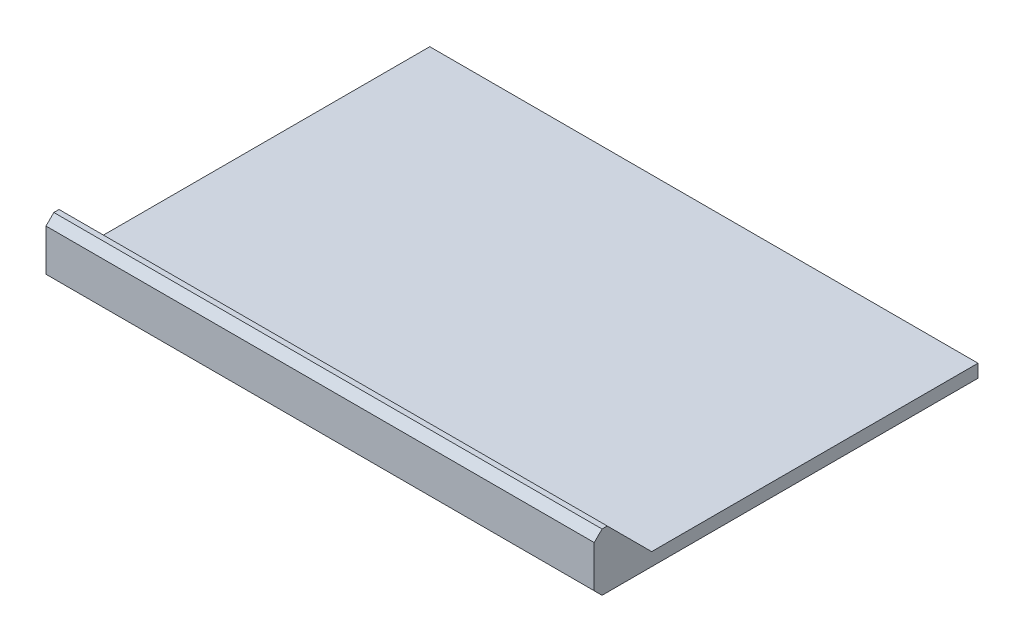
from build123d import *

# Parameters (mm, degrees)
SKETCH_1_W      = 533.4
SKETCH_1_H      = 360.68
EXTRUDE_1_DEPTH = 12.7
SKETCH_2_W      = 533.4
SKETCH_2_H      = 55.88
EXTRUDE_2_DEPTH = 12.7
CHAMFER1_SIZE   = 7.62
EXTRUDE1_DEPTH  = 12.7
EXTRUDE3_DEPTH  = 12.7


with BuildPart() as part:
    # 草图1 → 凸台-拉伸1 (new body)
    with BuildSketch(Plane(origin=(0, 0, 0), x_dir=(1, 0, 0), z_dir=(0, 1, 0))):
        with Locations((266.7, 180.34)):
            Rectangle(SKETCH_1_W, SKETCH_1_H)
    extrude(amount=EXTRUDE_1_DEPTH)

    # 草图2 → 凸台-拉伸2 (add)
    with BuildSketch(Plane.XY):
        with Locations((266.7, 27.94)):
            Rectangle(SKETCH_2_W, SKETCH_2_H)
    extrude(amount=EXTRUDE_2_DEPTH)

    # Chamfer1
    chamfer1_edges = [part.edges().sort_by_distance(p)[0] for p in [
        (266.7, 0, 12.7),
        (266.7, 55.88, 12.7),
    ]]
    chamfer(chamfer1_edges, length=CHAMFER1_SIZE)

    # Sketch1 → Extrude1 (add)
    with BuildSketch(Plane(origin=(533.4, 0, 0), x_dir=(0, 0, -1), z_dir=(1, 0, 0))):
        Polygon((0, 55.88), (0, 12.7), (43.18, 12.7), align=None)
    extrude(amount=-EXTRUDE1_DEPTH)

    # Sketch4 → Extrude3 (add)
    with BuildSketch(Plane.ZY):
        Polygon((0, 55.88), (0, 12.7), (-43.18, 12.7), align=None)
    extrude(amount=-EXTRUDE3_DEPTH)


solid = part.part
